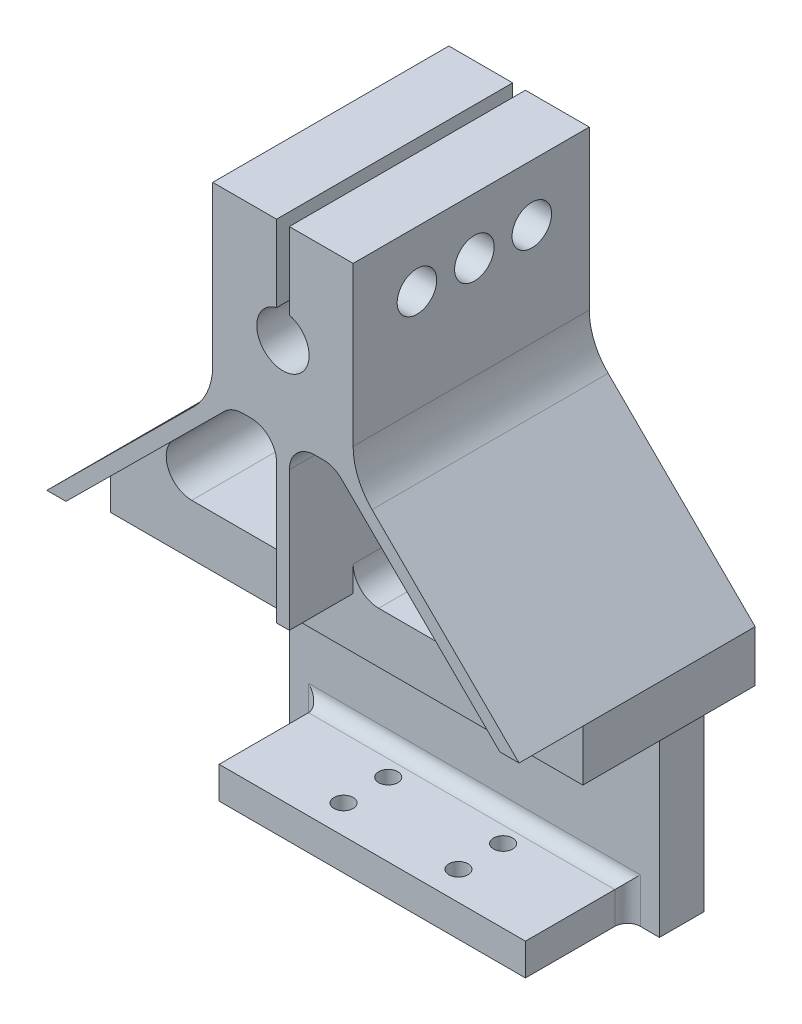
from build123d import *

# Parameters (mm, degrees)
SALIENTE_EXTRUIR1_DEPTH    = 7
CROQUIS2_7_W               = 74
CROQUIS2_7_H               = 8
SALIENTE_EXTRUIR3_DEPTH    = 27
SALIENTE_EXTRUIR5_DEPTH    = 37
CROQUIS10_R                = 1.9
CORTAR_EXTRUIR3_DEPTH      = 22
CROQUIS11_R                = 3.1
CORTAR_EXTRUIR4_DEPTH      = 6
CORTAR_EXTRUIR5_DEPTH      = 6
CORTAR_EXTRUIR6_START      = -7
CORTAR_EXTRUIR6_DEPTH      = 7
SALIENTE_EXTRUIR6_DEPTH    = 16
CROQUIS18_R                = 1.5
CORTAR_EXTRUIR8_DEPTH      = 10
CORTAR_EXTRUIR9_DEPTH      = 124.133618358
CORTAR_EXTRUIR9_DEPTH_BACK = 37
REDONDEO1_R                = 4
REDONDEO2_R                = 4
REDONDEO3_R                = 2
REDONDEO5_R                = 10


with BuildPart() as part:
    # Croquis2 → Saliente-Extruir1 (new body)
    with BuildSketch(Plane.XY):
        with BuildLine():
            Line((-47.286620614, 40.816010109), (-47.286620614, -49.183989891))
            ThreePointArc((-47.286620614, -49.183989891), (-45.236368082, -54.133737359), (-40.286620614, -56.183989891))
            Line((-40.286620614, -56.183989891), (3.713379386, -56.183989891))
            ThreePointArc((3.713379386, -56.183989891), (8.663126854, -54.133737359), (10.713379386, -49.183989891))
            Line((10.713379386, -49.183989891), (10.713379386, 40.816010109))
            Line((10.713379386, 40.816010109), (-47.286620614, 40.816010109))
        make_face()
    extrude(amount=SALIENTE_EXTRUIR1_DEPTH)

    # Croquis2<7> → Saliente-Extruir3 (add)
    with BuildSketch(Plane.XY):
        with Locations((-18.286620614, 44.816010109)):
            Rectangle(CROQUIS2_7_W, CROQUIS2_7_H)
    extrude(amount=SALIENTE_EXTRUIR3_DEPTH)

    # Croquis2<14> → Saliente-Extruir5 (add)
    with BuildSketch(Plane.XY):
        with BuildLine():
            Line((-55.286620614, 48.816010109), (-30.786620614, 48.816010109))
            Line((-30.786620614, 48.816010109), (-5.786620614, 48.816010109))
            Line((-5.786620614, 48.816010109), (18.713379386, 48.816010109))
            Line((18.713379386, 48.816010109), (-7.286620614, 74.616010109))
            Line((-7.286620614, 74.616010109), (-7.286620614, 103.616010109))
            Line((-7.286620614, 103.616010109), (-17.286620614, 103.616010109))
            Line((-17.286620614, 103.616010109), (-17.286620614, 91.616010109))
            ThreePointArc((-17.286620614, 91.616010109), (-18.286620614, 83.539831039), (-19.286620614, 91.616010109))
            Line((-19.286620614, 91.616010109), (-19.286620614, 103.616010109))
            Line((-19.286620614, 103.616010109), (-29.286620614, 103.616010109))
            Line((-29.286620614, 103.616010109), (-29.286620614, 74.616010109))
            Line((-29.286620614, 74.616010109), (-55.286620614, 48.816010109))
        make_face()
    extrude(amount=SALIENTE_EXTRUIR5_DEPTH)

    # Croquis10 → Cortar-Extruir3 (cut)
    with BuildSketch(Plane(origin=(-7.286620614, 0, 0), x_dir=(0, 0, -1), z_dir=(1, 0, 0))):
        with Locations((-9, 94.816010109)):
            Circle(CROQUIS10_R)
        with Locations((-18, 94.816010109)):
            Circle(CROQUIS10_R)
        with Locations((-27, 94.816010109)):
            Circle(CROQUIS10_R)
    extrude(amount=-CORTAR_EXTRUIR3_DEPTH, mode=Mode.SUBTRACT)

    # Croquis11 → Cortar-Extruir4 (cut)
    with BuildSketch(Plane(origin=(-7.286620614, 0, 0), x_dir=(0, 0, -1), z_dir=(1, 0, 0))):
        with Locations((-27, 94.816010109)):
            Circle(CROQUIS11_R)
        with Locations((-18, 94.816010109)):
            Circle(CROQUIS11_R)
        with Locations((-9, 94.816010109)):
            Circle(CROQUIS11_R)
    extrude(amount=-CORTAR_EXTRUIR4_DEPTH, mode=Mode.SUBTRACT)

    # Croquis12 → Cortar-Extruir5 (cut)
    with BuildSketch(Plane.ZY.offset(29.286620614)):
        Polygon((21.233161507, 94.816010109), (19.616580754, 97.616010109), (16.383419246, 97.616010109), (14.766838493, 94.816010109), (16.383419246, 92.016010109), (19.616580754, 92.016010109), align=None)
        Polygon((12.233161507, 94.816010109), (10.616580754, 97.616010109), (7.383419246, 97.616010109), (5.766838493, 94.816010109), (7.383419246, 92.016010109), (10.616580754, 92.016010109), align=None)
        Polygon((30.233161507, 94.816010109), (28.616580754, 97.616010109), (25.383419246, 97.616010109), (23.766838493, 94.816010109), (25.383419246, 92.016010109), (28.616580754, 92.016010109), align=None)
    extrude(amount=-CORTAR_EXTRUIR5_DEPTH, mode=Mode.SUBTRACT)

    # Croquis17 → Cortar-Extruir6 (cut)
    with BuildSketch(Plane.XY.offset(7).offset(CORTAR_EXTRUIR6_START)):
        with BuildLine():
            Line((-55.286620614, 6.139831039), (-55.286620614, -5.183989891))
            Line((-55.286620614, -5.183989891), (-47.286620614, -5.183989891))
            Line((-47.286620614, -5.183989891), (-47.286620614, -49.183989891))
            ThreePointArc((-47.286620614, -49.183989891), (-45.236368082, -54.133737359), (-40.286620614, -56.183989891))
            Line((-40.286620614, -56.183989891), (3.713379386, -56.183989891))
            ThreePointArc((3.713379386, -56.183989891), (8.663126854, -54.133737359), (10.713379386, -49.183989891))
            Line((10.713379386, -49.183989891), (10.713379386, -5.183989891))
            Line((10.713379386, -5.183989891), (18.713379386, -5.183989891))
            Line((18.713379386, -5.183989891), (18.713379386, 6.139831039))
            Line((18.713379386, 6.139831039), (-55.286620614, 6.139831039))
        make_face()
    extrude(amount=CORTAR_EXTRUIR6_DEPTH, mode=Mode.SUBTRACT)

    # Croquis17<5> → Saliente-Extruir6 (add)
    with BuildSketch(Plane.XY.offset(7)):
        Polygon((-42.286620614, 6.139831039), (-18.286620614, 6.139831039), (5.713379386, 6.139831039), (5.713379386, 11.139831039), (-42.286620614, 11.139831039), align=None)
    extrude(amount=SALIENTE_EXTRUIR6_DEPTH)

    # Croquis18 → Cortar-Extruir8 (cut)
    with BuildSketch(Plane.XZ.offset(-6.139831039)):
        with Locations((-27.286620614, 18.5)):
            Circle(CROQUIS18_R)
        with Locations((-9.286620614, 18.5)):
            Circle(CROQUIS18_R)
        with Locations((-27.286620614, 11.5)):
            Circle(CROQUIS18_R)
        with Locations((-9.286620614, 11.5)):
            Circle(CROQUIS18_R)
    extrude(amount=-CORTAR_EXTRUIR8_DEPTH, mode=Mode.SUBTRACT)

    # Croquis19 → Cortar-Extruir9 (cut, two sides: drawn at the far end of the back side and taken through both)
    with BuildSketch(Plane.XY.offset(37).offset(-CORTAR_EXTRUIR9_DEPTH_BACK)):
        Polygon((-52.286620614, 48.816010109), (-19.286620614, 48.816010109), (-19.286620614, 74.616010109), (-26.286620614, 74.616010109), align=None)
        Polygon((-17.286620614, 74.616010109), (-17.286620614, 48.816010109), (15.713379386, 48.816010109), (-10.286620614, 74.616010109), align=None)
    extrude(amount=CORTAR_EXTRUIR9_DEPTH + CORTAR_EXTRUIR9_DEPTH_BACK, mode=Mode.SUBTRACT)

    # Redondeo1
    redondeo1_edges = [part.edges().sort_by_distance(p)[0] for p in [
        (-19.286620614, 48.816010109, 13.5),
        (15.713379386, 48.816010109, 13.5),
        (-17.286620614, 74.616010109, 18.5),
        (-10.286620614, 74.616010109, 18.5),
        (-19.286620614, 74.616010109, 18.5),
        (-26.286620614, 74.616010109, 18.5),
        (-17.286620614, 48.816010109, 13.5),
        (-52.286620614, 48.816010109, 13.5),
    ]]
    fillet(redondeo1_edges, radius=REDONDEO1_R)

    # Redondeo2
    redondeo2_edges = [part.edges().sort_by_distance(p)[0] for p in [
        (-47.286620614, 40.816010109, 3.5),
        (10.713379386, 40.816010109, 3.5),
        (-18.286620614, 40.816010109, 7),
    ]]
    fillet(redondeo2_edges, radius=REDONDEO2_R)

    # Redondeo3
    redondeo3_edges = [part.edges().sort_by_distance(p)[0] for p in [
        (-18.286620614, 11.139831039, 7),
        (5.713379386, 8.639831039, 7),
        (-42.286620614, 8.639831039, 7),
    ]]
    fillet(redondeo3_edges, radius=REDONDEO3_R)

    # Redondeo5
    redondeo5_edges = [part.edges().sort_by_distance(p)[0] for p in [
        (-7.286620614, 74.616010109, 18.5),
        (-29.286620614, 74.616010109, 18.5),
    ]]
    fillet(redondeo5_edges, radius=REDONDEO5_R)


solid = part.part
